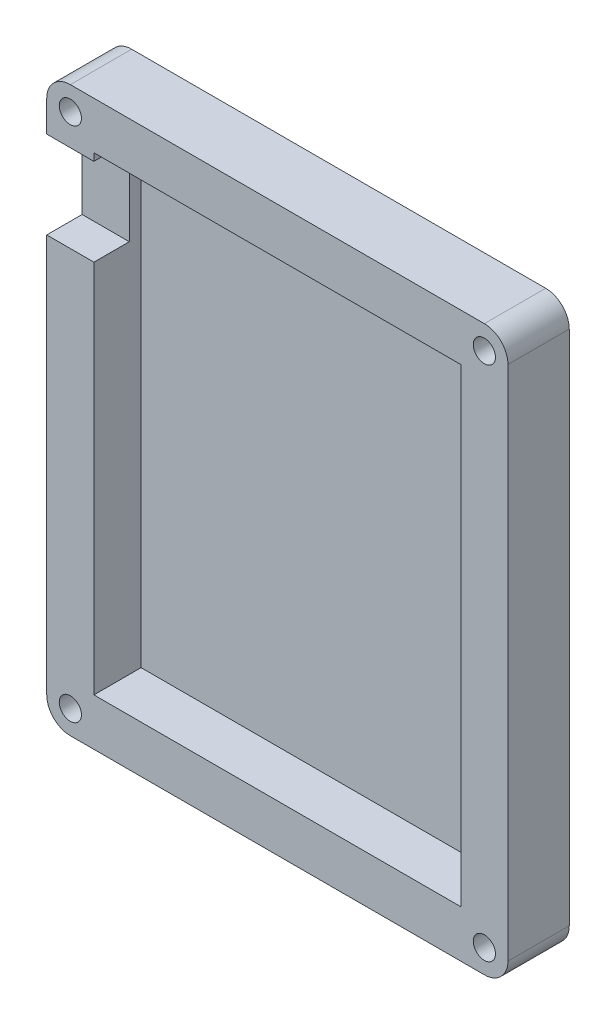
from build123d import *

# Parameters (mm, degrees)
SKETCH4_R             = 3
SKETCH4_R_2           = 2.35
BOSS_EXTRUDE1_DEPTH   = 9.9
BOSS_EXTRUDE1_2_DEPTH = 9.9
BOSS_EXTRUDE1_3_DEPTH = 9.9
BOSS_EXTRUDE1_4_DEPTH = 9.9
SKETCH1_R             = 3
BOSS_EXTRUDE2_DEPTH   = 13
BOSS_EXTRUDE3_DEPTH   = 3
SKETCH5_W             = 10
SKETCH5_H             = 18.5
CUT_EXTRUDE1_DEPTH    = 7.5
FILLET1_R             = 5
CUT_EXTRUDE2_DEPTH    = 0.2


with BuildPart() as part:
    # Sketch4 → Boss-Extrude1 (new body)
    with BuildSketch(Plane(origin=(0, 0, 3.1), x_dir=(0, 1, 0), z_dir=(0, 0, 1))):
        with Locations(Location((-54.765, -43.88, 0), (0, 0, 90))):
            Circle(SKETCH4_R)
        with Locations(Location((-54.765, -43.88, 0), (0, 0, 90))):
            Circle(SKETCH4_R_2, mode=Mode.SUBTRACT)
    extrude(amount=BOSS_EXTRUDE1_DEPTH)



with BuildPart() as body_2:
    # Sketch4 → Boss-Extrude1 2 (new body)
    with BuildSketch(Plane(origin=(0, 0, 3.1), x_dir=(0, 1, 0), z_dir=(0, 0, 1))):
        with Locations(Location((54.765, -43.88, 0), (0, 0, 90))):
            Circle(SKETCH4_R)
        with Locations(Location((54.765, -43.88, 0), (0, 0, 90))):
            Circle(SKETCH4_R_2, mode=Mode.SUBTRACT)
    extrude(amount=BOSS_EXTRUDE1_2_DEPTH)


with BuildPart() as body_3:
    # Sketch4 → Boss-Extrude1 3 (new body)
    with BuildSketch(Plane(origin=(0, 0, 3.1), x_dir=(0, 1, 0), z_dir=(0, 0, 1))):
        with Locations(Location((54.765, 43.88, 0), (0, 0, 90))):
            Circle(SKETCH4_R)
        with Locations(Location((54.765, 43.88, 0), (0, 0, 90))):
            Circle(SKETCH4_R_2, mode=Mode.SUBTRACT)
    extrude(amount=BOSS_EXTRUDE1_3_DEPTH)


with BuildPart() as body_4:
    # Sketch4 → Boss-Extrude1 4 (new body)
    with BuildSketch(Plane(origin=(0, 0, 3.1), x_dir=(0, 1, 0), z_dir=(0, 0, 1))):
        with Locations(Location((-54.765, 43.88, 0), (0, 0, 90))):
            Circle(SKETCH4_R)
        with Locations(Location((-54.765, 43.88, 0), (0, 0, 90))):
            Circle(SKETCH4_R_2, mode=Mode.SUBTRACT)
    extrude(amount=BOSS_EXTRUDE1_4_DEPTH)


with BuildPart() as part_1:
    add(part.part)

    add(body_2.part)  # Boss-Extrude2 merges body 2

    add(body_3.part)  # Boss-Extrude2 merges body 3

    add(body_4.part)  # Boss-Extrude2 merges body 4
    # Sketch1 → Boss-Extrude2 (add)
    with BuildSketch(Plane(origin=(0, 0, 0), x_dir=(0, 1, 0), z_dir=(0, 0, 1))):
        Polygon((59.765, 48.88), (59.765, 63.831620916), (59.765, -48.88), (-59.765, -48.88), (-59.765, 48.88), (18.337488683, 48.88), align=None)
        with Locations(Location((-54.765, -43.88, 0), (0, 0, 90))):
            Circle(SKETCH1_R, mode=Mode.SUBTRACT)
        with Locations(Location((54.765, -43.88, 0), (0, 0, 90))):
            Circle(SKETCH1_R, mode=Mode.SUBTRACT)
        with Locations(Location((54.765, 43.88, 0), (0, 0, 90))):
            Circle(SKETCH1_R, mode=Mode.SUBTRACT)
        with Locations(Location((-54.765, 43.88, 0), (0, 0, 90))):
            Circle(SKETCH1_R, mode=Mode.SUBTRACT)
        Polygon((18.074158975, 38.88), (49.765, 38.88), (49.765, 53.831620916), (49.765, -38.88), (-49.765, -38.88), (-49.765, 38.88), align=None, mode=Mode.SUBTRACT)
    extrude(amount=BOSS_EXTRUDE2_DEPTH)

    # Sketch1<10> → Boss-Extrude3 (add)
    with BuildSketch(Plane(origin=(0, 0, 0), x_dir=(0, 1, 0), z_dir=(0, 0, 1))):
        Polygon((49.765, 38.88), (49.765, 53.831620916), (49.765, -38.88), (-49.765, -38.88), (-49.765, 38.88), (18.074158975, 38.88), align=None)
    extrude(amount=BOSS_EXTRUDE3_DEPTH)

    # Sketch5 → Cut-Extrude1 (cut)
    with BuildSketch(Plane.XY.offset(13)):
        with Locations((-43.88, 38.925)):
            Rectangle(SKETCH5_W, SKETCH5_H)
    extrude(amount=-CUT_EXTRUDE1_DEPTH, mode=Mode.SUBTRACT)

    # Fillet1
    fillet1_edges = [part_1.edges().sort_by_distance(p)[0] for p in [
        (-48.88, 59.765, 6.5),
        (-48.88, -59.765, 6.5),
        (48.88, -59.765, 6.5),
        (48.88, 59.765, 6.5),
    ]]
    fillet(fillet1_edges, radius=FILLET1_R)

    # Sketch6 → Cut-Extrude2 (cut)
    # profile 1 of 17: a face of its own
    with BuildSketch(Plane(origin=(0, 0, 0), x_dir=(1, 0, 0), z_dir=(0, 0, -1))):
        Polygon((-25.373933233, -2.992088032), (-24.91189397, 0.507911968), (-24.867022175, 0.507911968), (-23.422010156, -2.363882904), (-21.980503746, 0.507911968), (-21.934930829, 0.507911968), (-21.470087079, -2.992088032), (-21.785591887, -2.992088032), (-22.120728105, -0.473658545), (-23.384149579, -2.992088032), (-23.45496288, -2.992088032), (-24.723292207, -0.468049571), (-25.057727303, -2.992088032), align=None)
    # profile 2 of 17: a face of its own
    with BuildSketch(Plane(origin=(0, 0, 0), x_dir=(1, 0, 0), z_dir=(0, 0, -1))):
        with BuildLine():
            add(Edge.make_bspline(
                [(-19.606505348, -0.38952393), (-19.558514075, -0.390545821), (-19.464414918, -0.3925495), (-19.326607032, -0.413964465), (-19.195061896, -0.44671183), (-19.069275704, -0.491983392), (-18.950859408, -0.552665342), (-18.838088164, -0.625074633), (-18.731271155, -0.710857227), (-18.667248126, -0.777215295), (-18.63475054, -0.810898128)],
                knots=[0, 0, 0, 0, 1.054011418, 2.066658804, 3.057071809, 4.030435133, 4.997543892, 5.974964718, 6.972108034, 8, 8, 8, 8], degree=3))
            add(Edge.make_bspline(
                [(-18.63475054, -0.810898128), (-18.606768586, -0.843112114), (-18.551346206, -0.906916656), (-18.480280487, -1.010372269), (-18.419058927, -1.11751237), (-18.369995966, -1.229759697), (-18.331310942, -1.346134368), (-18.303845246, -1.467036379), (-18.287508311, -1.592198726), (-18.285305344, -1.677202564), (-18.284189643, -1.720253096)],
                knots=[0, 0, 0, 0, 1.025258237, 2.030674902, 3.01204498, 3.988269485, 4.97094183, 5.956517959, 6.965070386, 8, 8, 8, 8], degree=3))
            add(Edge.make_bspline(
                [(-18.284189643, -1.720253096), (-18.28517098, -1.763553154), (-18.287110149, -1.849116087), (-18.305453765, -1.975135453), (-18.333984851, -2.097330276), (-18.374816689, -2.21518897), (-18.427174798, -2.329071797), (-18.491065486, -2.438481346), (-18.566937103, -2.54363348), (-18.6529411, -2.643635318), (-18.747992976, -2.735801533), (-18.851109124, -2.816129802), (-18.960263158, -2.884951327), (-19.076906511, -2.940387742), (-19.199973998, -2.984097442), (-19.329731066, -3.014797459), (-19.465976136, -3.033359143), (-19.559003358, -3.035742716), (-19.606505348, -3.036959827)],
                knots=[0, 0, 0, 0, 0.998656419, 1.973391657, 2.932242238, 3.890759089, 4.846373663, 5.82037756, 6.809684879, 7.83454468, 8.860553229, 9.859544525, 10.845671541, 11.83227036, 12.833544569, 13.85385346, 14.904124723, 16, 16, 16, 16], degree=3))
            add(Edge.make_bspline(
                [(-19.606505348, -3.036959827), (-19.654240068, -3.035738631), (-19.747730927, -3.033346856), (-19.884456909, -3.014869574), (-20.014446528, -2.984111591), (-20.137675127, -2.940244098), (-20.254819974, -2.884949555), (-20.364606471, -2.816337865), (-20.467806386, -2.73577771), (-20.562878371, -2.643641773), (-20.648876976, -2.543631816), (-20.724749984, -2.438481778), (-20.78864031, -2.329071685), (-20.840998514, -2.215189), (-20.881830327, -2.097330268), (-20.91036142, -1.975135455), (-20.928705034, -1.849116087), (-20.930644203, -1.763553154), (-20.93162554, -1.720253096)],
                knots=[0, 0, 0, 0, 1.099876186, 2.154163076, 3.173186993, 4.173200201, 5.163417411, 6.152872554, 7.150605724, 8.17532212, 9.198891216, 10.186952605, 11.159729845, 12.11414092, 13.071450619, 14.029093627, 15.002601286, 16, 16, 16, 16], degree=3))
            add(Edge.make_bspline(
                [(-20.93162554, -1.720253096), (-20.93050223, -1.67743655), (-20.928278269, -1.592667148), (-20.91195776, -1.467740087), (-20.884599203, -1.347042698), (-20.845867807, -1.231117222), (-20.796352616, -1.119361786), (-20.735991328, -1.011956955), (-20.664200695, -0.908969155), (-20.608998744, -0.845247075), (-20.581064643, -0.813001494)],
                knots=[0, 0, 0, 0, 1.031353054, 2.041901799, 3.029428768, 4.008703097, 4.981709435, 5.96992636, 6.972712378, 8, 8, 8, 8], degree=3))
            add(Edge.make_bspline(
                [(-20.581064643, -0.813001494), (-20.548616052, -0.779026555), (-20.484800188, -0.712208858), (-20.37745146, -0.626676334), (-20.264957639, -0.55276026), (-20.145232713, -0.493284045), (-20.019549855, -0.446445527), (-19.887330613, -0.413880012), (-19.749055097, -0.392626657), (-19.654495476, -0.390568479), (-19.606505348, -0.38952393)],
                knots=[0, 0, 0, 0, 1.027980169, 2.021703884, 2.998553061, 3.971491411, 4.943284454, 5.930300938, 6.949603206, 8, 8, 8, 8], degree=3))
        make_face()
        with BuildLine():
            add(Edge.make_bspline(
                [(-19.607907592, -0.703626494), (-19.641845203, -0.704591085), (-19.708844332, -0.706495368), (-19.807463916, -0.720979273), (-19.90240407, -0.743926777), (-19.993844914, -0.776530833), (-20.081478087, -0.818629732), (-20.165387489, -0.870338092), (-20.245819929, -0.930971049), (-20.321201993, -1.00043372), (-20.390384305, -1.076312715), (-20.450862281, -1.157161074), (-20.502287388, -1.24166742), (-20.545127547, -1.329919631), (-20.577034735, -1.422812045), (-20.600207757, -1.519292676), (-20.614677998, -1.619558093), (-20.616564376, -1.687719111), (-20.617522976, -1.722356462)],
                knots=[0, 0, 0, 0, 1.021534396, 2.016698045, 2.994645724, 3.958388632, 4.93408049, 5.916473867, 6.921342795, 7.962252576, 8.998418191, 10.008913653, 10.997312074, 11.973003931, 12.956656626, 13.948281152, 14.957379055, 16, 16, 16, 16], degree=3))
            add(Edge.make_bspline(
                [(-20.617522976, -1.722356462), (-20.615916153, -1.767108489), (-20.612726908, -1.855932894), (-20.586791672, -1.986744017), (-20.543405392, -2.112325869), (-20.484818112, -2.231942255), (-20.411411894, -2.342614533), (-20.324924827, -2.441286018), (-20.226285126, -2.526471829), (-20.116668626, -2.597152675), (-19.998314308, -2.65331243), (-19.873057987, -2.693111406), (-19.742417293, -2.718983098), (-19.653136562, -2.721554573), (-19.607907592, -2.722857263)],
                knots=[0, 0, 0, 0, 1.016792936, 2.018143844, 3.017858371, 4.030088057, 5.03801393, 6.028138512, 7.003788237, 7.991172063, 8.984598303, 9.972568034, 10.972917682, 12, 12, 12, 12], degree=3))
            add(Edge.make_bspline(
                [(-19.607907592, -2.722857263), (-19.562681223, -2.721546983), (-19.473405627, -2.718960526), (-19.34294645, -2.693241706), (-19.218032478, -2.653138045), (-19.099801091, -2.597215836), (-18.990234487, -2.526203421), (-18.890885366, -2.441767044), (-18.805136755, -2.342353192), (-18.73180315, -2.231795664), (-18.672256407, -2.112511311), (-18.629073205, -1.986720839), (-18.603075619, -1.855938797), (-18.599894791, -1.767110467), (-18.598292207, -1.722356462)],
                knots=[0, 0, 0, 0, 1.02726834, 2.027799167, 3.010890988, 4.004497153, 4.992059811, 5.971914811, 6.958719428, 7.966827853, 8.981595046, 9.981490638, 10.983022906, 12, 12, 12, 12], degree=3))
            add(Edge.make_bspline(
                [(-18.598292207, -1.722356462), (-18.599250477, -1.687718904), (-18.601136206, -1.619557478), (-18.615611171, -1.519295025), (-18.63876671, -1.422803428), (-18.670738328, -1.329951425), (-18.713392341, -1.241438921), (-18.765809134, -1.157409193), (-18.82604016, -1.076032647), (-18.896057281, -1.000679007), (-18.971360659, -0.93094397), (-19.051825697, -0.870314581), (-19.135610675, -0.818856985), (-19.222989258, -0.776170745), (-19.314441826, -0.744223404), (-19.409248955, -0.720846773), (-19.507447765, -0.706556576), (-19.574206808, -0.704609435), (-19.607907592, -0.703626494)],
                knots=[0, 0, 0, 0, 1.042956736, 2.052379634, 3.044323526, 4.02829302, 5.004299113, 5.996692471, 7.007513377, 8.048758398, 9.090003419, 10.095195979, 11.07790575, 12.047570684, 13.018257071, 13.989683339, 14.985167495, 16, 16, 16, 16], degree=3))
        make_face(mode=Mode.SUBTRACT)
    # profile 3 of 17: a face of its own
    with BuildSketch(Plane(origin=(0, 0, 0), x_dir=(1, 0, 0), z_dir=(0, 0, -1))):
        with BuildLine():
            Line((-15.053420412, -0.434395725), (-15.053420412, -2.992088032))
            Line((-15.053420412, -2.992088032), (-15.367522976, -2.992088032))
            Line((-15.367522976, -2.992088032), (-15.367522976, -2.54968018))
            add(Edge.make_bspline(
                [(-15.367522976, -2.54968018), (-15.402941767, -2.589719774), (-15.472061982, -2.667857545), (-15.5875031, -2.769939717), (-15.709871278, -2.854318039), (-15.838572599, -2.922467954), (-15.973490843, -2.973660011), (-16.11432693, -3.01004617), (-16.261138311, -3.033440005), (-16.361390665, -3.035776027), (-16.412194451, -3.036959827)],
                knots=[0, 0, 0, 0, 1.074387032, 2.096679803, 3.090159297, 4.057316773, 5.018401886, 5.985159533, 6.978961417, 8, 8, 8, 8], degree=3))
            add(Edge.make_bspline(
                [(-16.412194451, -3.036959827), (-16.457362404, -3.035733455), (-16.546435609, -3.033314994), (-16.677464687, -3.014552691), (-16.803556936, -2.984422069), (-16.924831509, -2.94252118), (-17.040503654, -2.886940358), (-17.151563751, -2.82039911), (-17.257436443, -2.74115828), (-17.356507982, -2.650570252), (-17.447739982, -2.552175264), (-17.527801255, -2.447229718), (-17.594554335, -2.336187414), (-17.650374415, -2.22045426), (-17.69337076, -2.09913934), (-17.723344394, -1.972662172), (-17.742084841, -1.841172299), (-17.744502301, -1.751632776), (-17.745728105, -1.70623066)],
                knots=[0, 0, 0, 0, 1.033919861, 2.038935746, 3.024066025, 3.998881131, 4.97069526, 5.957263378, 6.95902576, 7.993208707, 9.027059324, 10.027763471, 11.009749337, 11.988697705, 12.965288445, 13.950418724, 14.960734635, 16, 16, 16, 16], degree=3))
            add(Edge.make_bspline(
                [(-17.745728105, -1.70623066), (-17.744475133, -1.661766957), (-17.741998076, -1.573864614), (-17.723544856, -1.444585916), (-17.692513848, -1.320067655), (-17.648966, -1.200710712), (-17.593124045, -1.086370661), (-17.525195958, -0.976966636), (-17.445176833, -0.872197239), (-17.352924426, -0.774526012), (-17.252989656, -0.684305398), (-17.146080925, -0.605896352), (-17.034857644, -0.538179504), (-16.917594634, -0.484526027), (-16.796027529, -0.441116923), (-16.669074083, -0.411083955), (-16.537262504, -0.393386633), (-16.447772012, -0.390823869), (-16.402378746, -0.38952393)],
                knots=[0, 0, 0, 0, 1.020392517, 2.01726096, 2.990465484, 3.961182959, 4.928053699, 5.906110375, 6.912531644, 7.948652711, 8.985773172, 9.998621852, 10.987621588, 11.969261332, 12.953316658, 13.946091881, 14.958173133, 16, 16, 16, 16], degree=3))
            add(Edge.make_bspline(
                [(-16.402378746, -0.38952393), (-16.350178886, -0.390961681), (-16.247817426, -0.393781044), (-16.098089417, -0.417243771), (-15.956444939, -0.456882239), (-15.821790587, -0.510799737), (-15.694609901, -0.582448466), (-15.576106917, -0.672828427), (-15.465041434, -0.781369614), (-15.400661142, -0.864740058), (-15.367522976, -0.907652936)],
                knots=[0, 0, 0, 0, 1.038897134, 2.037228247, 3.008116434, 3.962042015, 4.918381754, 5.904844433, 6.921570401, 8, 8, 8, 8], degree=3))
            Line((-15.367522976, -0.907652936), (-15.367522976, -0.434395725))
            Line((-15.367522976, -0.434395725), (-15.053420412, -0.434395725))
        make_face()
        with BuildLine():
            add(Edge.make_bspline(
                [(-16.398172015, -0.703626494), (-16.444086353, -0.705260132), (-16.534713953, -0.708484673), (-16.667757955, -0.733658168), (-16.795071369, -0.775542762), (-16.916017443, -0.832824663), (-17.02868566, -0.9048534), (-17.12937933, -0.991974783), (-17.218922032, -1.091811797), (-17.294230296, -1.203913908), (-17.355620793, -1.324091999), (-17.398787825, -1.449716437), (-17.427257072, -1.578521414), (-17.430165593, -1.6658841), (-17.43162554, -1.709736269)],
                knots=[0, 0, 0, 0, 1.031046209, 2.035121221, 3.029706178, 4.034933723, 5.034054252, 6.02443088, 7.017295772, 8.038157696, 9.050218397, 10.03989886, 11.016116709, 12, 12, 12, 12], degree=3))
            add(Edge.make_bspline(
                [(-17.43162554, -1.709736269), (-17.429760647, -1.753326377), (-17.42603817, -1.840335732), (-17.399287476, -1.969316309), (-17.354407602, -2.094970351), (-17.29316554, -2.216231345), (-17.216478915, -2.328815445), (-17.127590262, -2.430555568), (-17.025639981, -2.518045156), (-16.912712474, -2.59128273), (-16.792104504, -2.650445251), (-16.665270572, -2.69161089), (-16.534594934, -2.718188671), (-16.4457426, -2.721293148), (-16.400976502, -2.722857263)],
                knots=[0, 0, 0, 0, 0.979072187, 1.954306742, 2.945804271, 3.96968567, 4.997920485, 5.998718438, 6.996577872, 8.005894225, 9.015743152, 10.005417472, 10.995077863, 12, 12, 12, 12], degree=3))
            add(Edge.make_bspline(
                [(-16.400976502, -2.722857263), (-16.355529999, -2.721197299), (-16.265141413, -2.717895795), (-16.131702705, -2.69261453), (-16.002207742, -2.650845732), (-15.878420514, -2.592946605), (-15.763104382, -2.521189249), (-15.659606505, -2.437182158), (-15.572090536, -2.339478974), (-15.497897927, -2.232102521), (-15.43972251, -2.114390525), (-15.397346451, -1.989056334), (-15.372292545, -1.856095586), (-15.369134816, -1.765231659), (-15.367522976, -1.718850853)],
                knots=[0, 0, 0, 0, 1.01762866, 2.023962475, 3.030623092, 4.058876274, 5.077231937, 6.066672613, 7.034107872, 8.005628644, 8.981990164, 9.965428785, 10.961468474, 12, 12, 12, 12], degree=3))
            add(Edge.make_bspline(
                [(-15.367522976, -1.718850853), (-15.368482633, -1.683513022), (-15.37037154, -1.613956989), (-15.38480211, -1.511829471), (-15.407757036, -1.414095745), (-15.440103206, -1.320653056), (-15.48259449, -1.232018041), (-15.533842256, -1.147554281), (-15.594747706, -1.067701069), (-15.664330402, -0.993557998), (-15.740495605, -0.925931536), (-15.821090145, -0.865567295), (-15.907068892, -0.815978523), (-15.996985929, -0.774937251), (-16.090997264, -0.742278101), (-16.189867884, -0.720490407), (-16.29254687, -0.705530086), (-16.362592926, -0.704267706), (-16.398172015, -0.703626494)],
                knots=[0, 0, 0, 0, 1.050140795, 2.067009409, 3.05949893, 4.030605086, 5.00011959, 5.97591094, 6.962425594, 7.979863591, 8.993523472, 9.986985069, 10.967611495, 11.937549037, 12.921786183, 13.919465291, 14.943216303, 16, 16, 16, 16], degree=3))
        make_face(mode=Mode.SUBTRACT)
    # profile 4 of 17: a face of its own
    with BuildSketch(Plane(origin=(0, 0, 0), x_dir=(1, 0, 0), z_dir=(0, 0, -1))):
        Polygon((-14.559830669, -0.434395725), (-12.630343489, -0.434395725), (-14.118123938, -2.677985468), (-12.675215284, -2.677985468), (-12.675215284, -2.992088032), (-14.694446053, -2.992088032), (-13.205964483, -0.748498289), (-14.559830669, -0.748498289), align=None)
    # profile 5 of 17: a face of its own
    with BuildSketch(Plane(origin=(0, 0, 0), x_dir=(1, 0, 0), z_dir=(0, 0, -1))):
        Polygon((-12.096088681, -0.479267519), (-12.31413756, -0.479267519), (-12.36111272, 0.597655557), (-12.047010156, 0.597655557), align=None)
    # profile 6 of 17: a face of its own
    with BuildSketch(Plane(origin=(0, 0, 0), x_dir=(1, 0, 0), z_dir=(0, 0, -1))):
        with BuildLine():
            Line((-10.117522976, -0.753406141), (-10.330664002, -0.972857263))
            add(Edge.make_bspline(
                [(-10.330664002, -0.972857263), (-10.349054505, -0.951544117), (-10.384509231, -0.91045488), (-10.440740712, -0.855517813), (-10.496764316, -0.809380874), (-10.551813129, -0.770428615), (-10.607271398, -0.740979469), (-10.662488317, -0.719484607), (-10.717521055, -0.706182801), (-10.75430709, -0.704468362), (-10.772370733, -0.703626494)],
                knots=[0, 0, 0, 0, 1.26578478, 2.440284043, 3.530471711, 4.527705817, 5.468200915, 6.346673037, 7.188140097, 8, 8, 8, 8], degree=3))
            add(Edge.make_bspline(
                [(-10.772370733, -0.703626494), (-10.794510123, -0.704701367), (-10.838077308, -0.706816565), (-10.900503127, -0.727929995), (-10.958453752, -0.760338733), (-11.008610732, -0.806307317), (-11.051098412, -0.859071586), (-11.082112093, -0.918067911), (-11.101078077, -0.981515954), (-11.103482809, -1.025545812), (-11.104702463, -1.047877295)],
                knots=[0, 0, 0, 0, 0.99966794, 1.967205029, 2.953328237, 3.988086729, 5.028030931, 6.008226631, 6.989793394, 8, 8, 8, 8], degree=3))
            add(Edge.make_bspline(
                [(-11.104702463, -1.047877295), (-11.103591651, -1.068089339), (-11.101373158, -1.10845645), (-11.084126479, -1.168004484), (-11.056660407, -1.226061522), (-11.030990212, -1.261624428), (-11.017763361, -1.279948609)],
                knots=[0, 0, 0, 0, 0.960159726, 1.917612774, 2.927026955, 4, 4, 4, 4], degree=3))
            add(Edge.make_bspline(
                [(-11.017763361, -1.279948609), (-11.009799867, -1.289733194), (-10.992850574, -1.310558448), (-10.961042059, -1.339462301), (-10.925019556, -1.371404552), (-10.881699619, -1.403341389), (-10.832948591, -1.436973115), (-10.777709307, -1.470975248), (-10.717734802, -1.507939673), (-10.674797495, -1.531384108), (-10.652478906, -1.543570404)],
                knots=[0, 0, 0, 0, 0.66740084, 1.420478572, 2.27185888, 3.217733974, 4.268547843, 5.408967954, 6.65319498, 8, 8, 8, 8], degree=3))
            add(Edge.make_bspline(
                [(-10.652478906, -1.543570404), (-10.625265329, -1.558815307), (-10.572697659, -1.588263439), (-10.498004891, -1.633973143), (-10.43021785, -1.679404567), (-10.368762183, -1.724071841), (-10.314820374, -1.769224709), (-10.266755821, -1.813132466), (-10.225767377, -1.857121774), (-10.202813451, -1.887854887), (-10.191841887, -1.902544763)],
                knots=[0, 0, 0, 0, 1.27191281, 2.456916733, 3.569705269, 4.599008579, 5.553216877, 6.436649441, 7.252746552, 8, 8, 8, 8], degree=3))
            add(Edge.make_bspline(
                [(-10.191841887, -1.902544763), (-10.173631359, -1.932210851), (-10.13738903, -1.991251872), (-10.099330763, -2.0884703), (-10.077270489, -2.191580802), (-10.074208268, -2.262113022), (-10.072651181, -2.297977455)],
                knots=[0, 0, 0, 0, 0.995354457, 1.980940102, 2.973342416, 4, 4, 4, 4], degree=3))
            add(Edge.make_bspline(
                [(-10.072651181, -2.297977455), (-10.073370715, -2.323246602), (-10.074788635, -2.373042215), (-10.084646702, -2.446377044), (-10.101601678, -2.516511602), (-10.124695432, -2.584206887), (-10.155879805, -2.648165826), (-10.192427603, -2.710002075), (-10.236302514, -2.768378006), (-10.28639389, -2.823216966), (-10.341239384, -2.873302714), (-10.399745522, -2.917326667), (-10.461984353, -2.953901005), (-10.527511154, -2.98416635), (-10.596474808, -3.008234608), (-10.668886098, -3.024897139), (-10.744514852, -3.0348699), (-10.79594466, -3.036254376), (-10.82215038, -3.036959827)],
                knots=[0, 0, 0, 0, 1.032770009, 2.035186124, 3.017557409, 3.978232242, 4.952395191, 5.920591857, 6.910227898, 7.931268572, 8.952309245, 9.941945286, 10.918353717, 11.897095711, 12.887975737, 13.898235213, 14.929059601, 16, 16, 16, 16], degree=3))
            add(Edge.make_bspline(
                [(-10.82215038, -3.036959827), (-10.857517556, -3.035967127), (-10.927760483, -3.03399552), (-11.031650202, -3.015489458), (-11.13317096, -2.986694065), (-11.231554501, -2.94697813), (-11.324600615, -2.896827417), (-11.409731539, -2.836765024), (-11.487243002, -2.768775027), (-11.531361275, -2.716662116), (-11.553420412, -2.69060566)],
                knots=[0, 0, 0, 0, 1.013940152, 2.01379169, 3.017749504, 4.037548394, 5.051665909, 6.043208538, 7.021604269, 8, 8, 8, 8], degree=3))
            Line((-11.553420412, -2.69060566), (-11.345187239, -2.453626494))
            add(Edge.make_bspline(
                [(-11.345187239, -2.453626494), (-11.325414826, -2.474981258), (-11.287083014, -2.516380698), (-11.225781797, -2.571505039), (-11.163402396, -2.61770631), (-11.100567709, -2.656349725), (-11.036347615, -2.686125128), (-10.971102001, -2.707043722), (-10.904963577, -2.720487914), (-10.860541441, -2.722066196), (-10.838276181, -2.722857263)],
                knots=[0, 0, 0, 0, 1.179806542, 2.287233372, 3.337373186, 4.324005949, 5.273901747, 6.200048787, 7.097828587, 8, 8, 8, 8], degree=3))
            add(Edge.make_bspline(
                [(-10.838276181, -2.722857263), (-10.807958255, -2.721486438), (-10.748722114, -2.718808076), (-10.663878355, -2.694490984), (-10.585539729, -2.656361032), (-10.517516383, -2.602276334), (-10.459614222, -2.539320762), (-10.417686048, -2.468406642), (-10.391409872, -2.391615186), (-10.388323874, -2.338382883), (-10.386753746, -2.311298769)],
                knots=[0, 0, 0, 0, 1.072336372, 2.095165389, 3.102688358, 4.141489647, 5.156069229, 6.117746104, 7.042326257, 8, 8, 8, 8], degree=3))
            add(Edge.make_bspline(
                [(-10.386753746, -2.311298769), (-10.38784004, -2.288989151), (-10.389984783, -2.244941795), (-10.406828055, -2.181191454), (-10.433440907, -2.120722173), (-10.459645555, -2.085332526), (-10.472991726, -2.067308385)],
                knots=[0, 0, 0, 0, 1.013901739, 2.00181326, 2.98231254, 4, 4, 4, 4], degree=3))
            add(Edge.make_bspline(
                [(-10.472991726, -2.067308385), (-10.481014121, -2.058273023), (-10.498489793, -2.038590741), (-10.530545034, -2.010165662), (-10.568926897, -1.979527563), (-10.61406706, -1.947195974), (-10.666056522, -1.913597368), (-10.725105997, -1.878908016), (-10.790406549, -1.84148029), (-10.836577181, -1.816660635), (-10.860712079, -1.80368659)],
                knots=[0, 0, 0, 0, 0.615000592, 1.339693406, 2.178160186, 3.116406724, 4.166410947, 5.330106347, 6.604359322, 8, 8, 8, 8], degree=3))
            add(Edge.make_bspline(
                [(-10.860712079, -1.80368659), (-10.886758719, -1.789147458), (-10.937271466, -1.760951442), (-11.008818757, -1.717035362), (-11.073366112, -1.672368087), (-11.132466686, -1.629455248), (-11.184627692, -1.586034304), (-11.22964364, -1.542057052), (-11.269286856, -1.499297066), (-11.291234268, -1.46899977), (-11.301717688, -1.454527936)],
                knots=[0, 0, 0, 0, 1.262093308, 2.447601706, 3.550203992, 4.582594899, 5.537233252, 6.418365656, 7.244515135, 8, 8, 8, 8], degree=3))
            add(Edge.make_bspline(
                [(-11.301717688, -1.454527936), (-11.319848287, -1.425382321), (-11.356115823, -1.367080906), (-11.391331014, -1.269770429), (-11.415537043, -1.167325372), (-11.417699433, -1.096638517), (-11.418805028, -1.060497487)],
                knots=[0, 0, 0, 0, 0.985009483, 1.970363186, 2.962279964, 4, 4, 4, 4], degree=3))
            add(Edge.make_bspline(
                [(-11.418805028, -1.060497487), (-11.418270832, -1.036872089), (-11.417225336, -0.990633838), (-11.408881285, -0.922695018), (-11.393689574, -0.858146864), (-11.374634651, -0.796020001), (-11.348151647, -0.737517907), (-11.316505741, -0.681860436), (-11.279318316, -0.629124518), (-11.236475026, -0.580121386), (-11.18936838, -0.53561206), (-11.138473611, -0.496813432), (-11.084935354, -0.463707077), (-11.028526934, -0.435941916), (-10.968706462, -0.414940534), (-10.905892075, -0.400483149), (-10.84021092, -0.390827946), (-10.795309794, -0.389964862), (-10.772370733, -0.38952393)],
                knots=[0, 0, 0, 0, 1.087655834, 2.128696564, 3.144119009, 4.137814668, 5.115653402, 6.093965665, 7.082169637, 8.081268856, 9.086088321, 10.061021666, 11.022561449, 11.980240094, 12.950172527, 13.934149372, 14.944599409, 16, 16, 16, 16], degree=3))
            add(Edge.make_bspline(
                [(-10.772370733, -0.38952393), (-10.745178669, -0.39062827), (-10.690284447, -0.392857668), (-10.607929821, -0.410563359), (-10.525696479, -0.439696463), (-10.443373129, -0.479932696), (-10.36156284, -0.531999572), (-10.279545983, -0.594928871), (-10.196337953, -0.668306586), (-10.14438164, -0.724405811), (-10.117522976, -0.753406141)],
                knots=[0, 0, 0, 0, 0.845714091, 1.707292901, 2.609013841, 3.555613372, 4.552488639, 5.621697636, 6.770543573, 8, 8, 8, 8], degree=3))
        make_face()
    # profile 7 of 17: a face of its own
    with BuildSketch(Plane(origin=(0, 0, 0), x_dir=(1, 0, 0), z_dir=(0, 0, -1))):
        Polygon((-8.008548617, 0.507911968), (-7.694446053, 0.507911968), (-7.694446053, -0.927985468), (-5.899574258, -0.927985468), (-5.899574258, 0.507911968), (-5.585471694, 0.507911968), (-5.585471694, -2.992088032), (-5.899574258, -2.992088032), (-5.899574258, -1.286959827), (-7.694446053, -1.286959827), (-7.694446053, -2.992088032), (-8.008548617, -2.992088032), align=None)
    # profile 8 of 17: a face of its own
    with BuildSketch(Plane(origin=(0, 0, 0), x_dir=(1, 0, 0), z_dir=(0, 0, -1))):
        with BuildLine():
            Line((-2.175215284, -0.434395725), (-2.175215284, -2.992088032))
            Line((-2.175215284, -2.992088032), (-2.489317848, -2.992088032))
            Line((-2.489317848, -2.992088032), (-2.489317848, -2.54968018))
            add(Edge.make_bspline(
                [(-2.489317848, -2.54968018), (-2.524736639, -2.589719774), (-2.593856854, -2.667857545), (-2.709297972, -2.769939717), (-2.83166615, -2.854318039), (-2.960367471, -2.922467954), (-3.095285714, -2.973660011), (-3.236121802, -3.01004617), (-3.382933182, -3.033440005), (-3.483185537, -3.035776027), (-3.533989322, -3.036959827)],
                knots=[0, 0, 0, 0, 1.074387032, 2.096679803, 3.090159297, 4.057316773, 5.018401886, 5.985159533, 6.978961417, 8, 8, 8, 8], degree=3))
            add(Edge.make_bspline(
                [(-3.533989322, -3.036959827), (-3.579157276, -3.035733455), (-3.668230481, -3.033314994), (-3.799259558, -3.014552691), (-3.925351808, -2.984422069), (-4.04662638, -2.94252118), (-4.162298526, -2.886940358), (-4.273358623, -2.82039911), (-4.379231315, -2.74115828), (-4.478302854, -2.650570252), (-4.569534854, -2.552175264), (-4.649596127, -2.447229718), (-4.716349206, -2.336187414), (-4.772169287, -2.22045426), (-4.815165632, -2.09913934), (-4.845139266, -1.972662172), (-4.863879712, -1.841172299), (-4.866297173, -1.751632776), (-4.867522976, -1.70623066)],
                knots=[0, 0, 0, 0, 1.033919861, 2.038935746, 3.024066025, 3.998881131, 4.97069526, 5.957263378, 6.95902576, 7.993208707, 9.027059324, 10.027763471, 11.009749337, 11.988697705, 12.965288445, 13.950418724, 14.960734635, 16, 16, 16, 16], degree=3))
            add(Edge.make_bspline(
                [(-4.867522976, -1.70623066), (-4.866270005, -1.661766957), (-4.863792948, -1.573864614), (-4.845339728, -1.444585916), (-4.81430872, -1.320067655), (-4.770760872, -1.200710712), (-4.714918917, -1.086370661), (-4.64699083, -0.976966636), (-4.566971705, -0.872197239), (-4.474719298, -0.774526012), (-4.374784528, -0.684305398), (-4.267875797, -0.605896352), (-4.156652516, -0.538179504), (-4.039389505, -0.484526027), (-3.9178224, -0.441116923), (-3.790868955, -0.411083955), (-3.659057376, -0.393386633), (-3.569566884, -0.390823869), (-3.524173617, -0.38952393)],
                knots=[0, 0, 0, 0, 1.020392517, 2.01726096, 2.990465484, 3.961182959, 4.928053699, 5.906110375, 6.912531644, 7.948652711, 8.985773172, 9.998621852, 10.987621588, 11.969261332, 12.953316658, 13.946091881, 14.958173133, 16, 16, 16, 16], degree=3))
            add(Edge.make_bspline(
                [(-3.524173617, -0.38952393), (-3.471973758, -0.390961681), (-3.369612298, -0.393781044), (-3.219884289, -0.417243771), (-3.078239811, -0.456882239), (-2.943585459, -0.510799737), (-2.816404773, -0.582448466), (-2.697901789, -0.672828427), (-2.586836305, -0.781369614), (-2.522456014, -0.864740058), (-2.489317848, -0.907652936)],
                knots=[0, 0, 0, 0, 1.038897134, 2.037228247, 3.008116434, 3.962042015, 4.918381754, 5.904844433, 6.921570401, 8, 8, 8, 8], degree=3))
            Line((-2.489317848, -0.907652936), (-2.489317848, -0.434395725))
            Line((-2.489317848, -0.434395725), (-2.175215284, -0.434395725))
        make_face()
        with BuildLine():
            add(Edge.make_bspline(
                [(-3.519966887, -0.703626494), (-3.565881224, -0.705260132), (-3.656508824, -0.708484673), (-3.789552826, -0.733658168), (-3.916866241, -0.775542762), (-4.037812315, -0.832824663), (-4.150480531, -0.9048534), (-4.251174202, -0.991974783), (-4.340716904, -1.091811797), (-4.416025168, -1.203913908), (-4.477415665, -1.324091999), (-4.520582697, -1.449716437), (-4.549051944, -1.578521414), (-4.551960465, -1.6658841), (-4.553420412, -1.709736269)],
                knots=[0, 0, 0, 0, 1.031046209, 2.035121221, 3.029706178, 4.034933723, 5.034054252, 6.02443088, 7.017295772, 8.038157696, 9.050218397, 10.03989886, 11.016116709, 12, 12, 12, 12], degree=3))
            add(Edge.make_bspline(
                [(-4.553420412, -1.709736269), (-4.551555519, -1.753326377), (-4.547833042, -1.840335732), (-4.521082348, -1.969316309), (-4.476202474, -2.094970351), (-4.414960411, -2.216231345), (-4.338273787, -2.328815445), (-4.249385134, -2.430555568), (-4.147434853, -2.518045156), (-4.034507346, -2.59128273), (-3.913899375, -2.650445251), (-3.787065444, -2.69161089), (-3.656389806, -2.718188671), (-3.567537472, -2.721293148), (-3.522771374, -2.722857263)],
                knots=[0, 0, 0, 0, 0.979072187, 1.954306742, 2.945804271, 3.96968567, 4.997920485, 5.998718438, 6.996577872, 8.005894225, 9.015743152, 10.005417472, 10.995077863, 12, 12, 12, 12], degree=3))
            add(Edge.make_bspline(
                [(-3.522771374, -2.722857263), (-3.477324871, -2.721197299), (-3.386936284, -2.717895795), (-3.253497577, -2.69261453), (-3.124002614, -2.650845732), (-3.000215385, -2.592946605), (-2.884899254, -2.521189249), (-2.781401377, -2.437182158), (-2.693885408, -2.339478974), (-2.619692799, -2.232102521), (-2.561517382, -2.114390525), (-2.519141323, -1.989056334), (-2.494087417, -1.856095586), (-2.490929687, -1.765231659), (-2.489317848, -1.718850853)],
                knots=[0, 0, 0, 0, 1.01762866, 2.023962475, 3.030623092, 4.058876274, 5.077231937, 6.066672613, 7.034107872, 8.005628644, 8.981990164, 9.965428785, 10.961468474, 12, 12, 12, 12], degree=3))
            add(Edge.make_bspline(
                [(-2.489317848, -1.718850853), (-2.490277504, -1.683513022), (-2.492166412, -1.613956989), (-2.506596981, -1.511829471), (-2.529551908, -1.414095745), (-2.561898078, -1.320653056), (-2.604389362, -1.232018041), (-2.655637128, -1.147554281), (-2.716542578, -1.067701069), (-2.786125274, -0.993557998), (-2.862290477, -0.925931536), (-2.942885017, -0.865567295), (-3.028863764, -0.815978523), (-3.118780801, -0.774937251), (-3.212792136, -0.742278101), (-3.311662755, -0.720490407), (-3.414341742, -0.705530086), (-3.484387798, -0.704267706), (-3.519966887, -0.703626494)],
                knots=[0, 0, 0, 0, 1.050140795, 2.067009409, 3.05949893, 4.030605086, 5.00011959, 5.97591094, 6.962425594, 7.979863591, 8.993523472, 9.986985069, 10.967611495, 11.937549037, 12.921786183, 13.919465291, 14.943216303, 16, 16, 16, 16], degree=3))
        make_face(mode=Mode.SUBTRACT)
    # profile 9 of 17: a face of its own
    with BuildSketch(Plane(origin=(0, 0, 0), x_dir=(1, 0, 0), z_dir=(0, 0, -1))):
        with BuildLine():
            Line((1.055553947, -0.988983064), (0.792633274, -1.152344443))
            add(Edge.make_bspline(
                [(0.792633274, -1.152344443), (0.763803408, -1.116516049), (0.707056713, -1.045993938), (0.608517477, -0.954984005), (0.503506063, -0.876816963), (0.390228015, -0.813113212), (0.268842215, -0.763891762), (0.139827363, -0.729061557), (0.003201859, -0.707357314), (-0.09046334, -0.704890477), (-0.13845647, -0.703626494)],
                knots=[0, 0, 0, 0, 1.026593902, 2.0206758, 2.988051866, 3.946915611, 4.916868779, 5.907761954, 6.927957743, 8, 8, 8, 8], degree=3))
            add(Edge.make_bspline(
                [(-0.13845647, -0.703626494), (-0.176815427, -0.704683336), (-0.252362349, -0.706764758), (-0.363268503, -0.719775251), (-0.468910856, -0.74341726), (-0.569951565, -0.774568216), (-0.665671983, -0.816318506), (-0.756322902, -0.867128262), (-0.842708392, -0.926178303), (-0.922325133, -0.994588848), (-0.99515414, -1.068987516), (-1.058253054, -1.148741211), (-1.113189988, -1.231461102), (-1.156295944, -1.319212845), (-1.191571114, -1.409988898), (-1.214777835, -1.505502753), (-1.23024253, -1.604530761), (-1.232011859, -1.672049101), (-1.232907592, -1.70623066)],
                knots=[0, 0, 0, 0, 1.112346261, 2.190735716, 3.231507886, 4.247384806, 5.251966152, 6.253067467, 7.256802811, 8.280671706, 9.291813951, 10.270744147, 11.225547591, 12.165006084, 13.100104208, 14.043489273, 15.009504848, 16, 16, 16, 16], degree=3))
            add(Edge.make_bspline(
                [(-1.232907592, -1.70623066), (-1.231128339, -1.750999871), (-1.227593809, -1.839935067), (-1.199892349, -1.971213169), (-1.154547942, -2.098136859), (-1.092490091, -2.219804997), (-1.014012957, -2.332399152), (-0.921840394, -2.433382606), (-0.81592131, -2.520798634), (-0.69718898, -2.593271159), (-0.568431236, -2.651532527), (-0.431041131, -2.69303986), (-0.286141351, -2.718092233), (-0.186934604, -2.721248176), (-0.136353105, -2.722857263)],
                knots=[0, 0, 0, 0, 0.966302908, 1.919585723, 2.883856336, 3.870342332, 4.860282998, 5.839159637, 6.814385684, 7.815993281, 8.834850808, 9.858348828, 10.908058873, 12, 12, 12, 12], degree=3))
            add(Edge.make_bspline(
                [(-0.136353105, -2.722857263), (-0.08999792, -2.721557766), (0.001102318, -2.719003909), (0.134269603, -2.697474946), (0.261049514, -2.662231312), (0.381437545, -2.613083662), (0.495213711, -2.549556146), (0.601642886, -2.471196975), (0.702842824, -2.380260375), (0.762339801, -2.309942404), (0.792633274, -2.274139314)],
                knots=[0, 0, 0, 0, 1.039848629, 2.043578496, 3.018386758, 3.987534228, 4.954977003, 5.934852016, 6.948509513, 8, 8, 8, 8], degree=3))
            Line((0.792633274, -2.274139314), (1.055553947, -2.446615276))
            add(Edge.make_bspline(
                [(1.055553947, -2.446615276), (1.039966245, -2.469506003), (1.008842578, -2.515211479), (0.956814952, -2.579655596), (0.900695121, -2.639977278), (0.840702024, -2.696095668), (0.777619014, -2.749353688), (0.709291104, -2.797205262), (0.637921493, -2.842340085), (0.562672335, -2.882952957), (0.484321637, -2.919459279), (0.402979647, -2.950850449), (0.318999835, -2.977820555), (0.232283458, -2.999257902), (0.14265956, -3.016368741), (0.050359926, -3.027722442), (-0.044583656, -3.036197723), (-0.108755807, -3.03670359), (-0.141260957, -3.036959827)],
                knots=[0, 0, 0, 0, 0.954134338, 1.905101784, 2.851144739, 3.791306361, 4.734911809, 5.6936923, 6.663572882, 7.643865596, 8.638447847, 9.640600242, 10.646758161, 11.676244097, 12.717260333, 13.78922464, 14.880174919, 16, 16, 16, 16], degree=3))
            add(Edge.make_bspline(
                [(-0.141260957, -3.036959827), (-0.190871841, -3.036068547), (-0.288109533, -3.034321632), (-0.43043204, -3.015113157), (-0.566445708, -2.986155541), (-0.696104066, -2.944591807), (-0.8194273, -2.891087032), (-0.936300418, -2.825730117), (-1.046336436, -2.747978327), (-1.148447219, -2.659215558), (-1.242228665, -2.562974917), (-1.322754856, -2.459124999), (-1.392600126, -2.351483951), (-1.448687669, -2.237674425), (-1.493334596, -2.119209052), (-1.523839428, -1.995138812), (-1.543569166, -1.866486558), (-1.545852546, -1.778753676), (-1.547010156, -1.734275532)],
                knots=[0, 0, 0, 0, 1.1129367, 2.181364009, 3.217532258, 4.231199276, 5.232079859, 6.230262199, 7.231623845, 8.250719726, 9.263571943, 10.242672461, 11.195837495, 12.138959767, 13.085126421, 14.0317438, 15.002148558, 16, 16, 16, 16], degree=3))
            add(Edge.make_bspline(
                [(-1.547010156, -1.734275532), (-1.54656914, -1.704097098), (-1.545691886, -1.64406721), (-1.535629958, -1.554972144), (-1.522631485, -1.467063598), (-1.500605748, -1.381455879), (-1.475165116, -1.296850589), (-1.442689585, -1.214267488), (-1.40459419, -1.133322815), (-1.361342242, -1.054225085), (-1.312653497, -0.978275546), (-1.258772264, -0.906521881), (-1.201727928, -0.838102116), (-1.138851816, -0.775378355), (-1.072812162, -0.715842164), (-1.001740586, -0.661084039), (-0.926044735, -0.610943048), (-0.846861412, -0.564492033), (-0.764236701, -0.523132598), (-0.67867003, -0.48749936), (-0.590677001, -0.457046784), (-0.500116857, -0.432937865), (-0.407590684, -0.412720441), (-0.312369346, -0.400002595), (-0.214817123, -0.391016322), (-0.148761101, -0.39002553), (-0.115319451, -0.38952393)],
                knots=[0, 0, 0, 0, 0.990994727, 1.971252077, 2.943264845, 3.907940874, 4.872158414, 5.844625996, 6.82015047, 7.809835459, 8.804511986, 9.781214284, 10.756496977, 11.728388426, 12.696359165, 13.676225489, 14.672885716, 15.677705647, 16.690706858, 17.706033469, 18.721040654, 19.747369689, 20.783475414, 21.830280724, 22.901553713, 24, 24, 24, 24], degree=3))
            add(Edge.make_bspline(
                [(-0.115319451, -0.38952393), (-0.073439343, -0.390445821), (0.010111537, -0.392284995), (0.134052244, -0.407763647), (0.256167438, -0.431100063), (0.374314541, -0.465672893), (0.487061055, -0.507536549), (0.592596506, -0.554549263), (0.68843661, -0.609143867), (0.776364199, -0.668863981), (0.856543716, -0.736224887), (0.929798209, -0.812031844), (0.997629858, -0.895890323), (1.036086569, -0.957696055), (1.055553947, -0.988983064)],
                knots=[0, 0, 0, 0, 1.095225653, 2.184976855, 3.262915854, 4.344593502, 5.400796181, 6.407717688, 7.363229445, 8.282371371, 9.184954523, 10.097238608, 11.036792983, 12, 12, 12, 12], degree=3))
        make_face()
    # profile 10 of 17: a face of its own
    with BuildSketch(Plane(origin=(0, 0, 0), x_dir=(1, 0, 0), z_dir=(0, 0, -1))):
        Polygon((1.683759075, 0.597655557), (1.997861639, 0.597655557), (1.997861639, -1.477664955), (3.161723819, -0.434395725), (3.613246254, -0.434395725), (2.262885678, -1.645934186), (3.747861639, -2.992088032), (3.297040325, -2.992088032), (1.997861639, -1.813502295), (1.997861639, -2.992088032), (1.683759075, -2.992088032), align=None)
    # profile 11 of 17: a face of its own
    with BuildSketch(Plane(origin=(0, 0, 0), x_dir=(1, 0, 0), z_dir=(0, 0, -1))):
        with BuildLine():
            Line((4.196579588, 0.507911968), (4.882977825, 0.507911968))
            add(Edge.make_bspline(
                [(4.882977825, 0.507911968), (4.930188731, 0.507860072), (5.020646924, 0.507760636), (5.15036198, 0.50474589), (5.268171711, 0.500719198), (5.373822092, 0.495137305), (5.46763819, 0.488540715), (5.54919549, 0.479288675), (5.619135046, 0.46962838), (5.661041496, 0.459806973), (5.680153306, 0.455327833)],
                knots=[0, 0, 0, 0, 1.415646017, 2.712440637, 3.8905458, 4.950247383, 5.884950622, 6.709939814, 7.411656543, 8, 8, 8, 8], degree=3))
            add(Edge.make_bspline(
                [(5.680153306, 0.455327833), (5.70434684, 0.448705883), (5.752163817, 0.435618022), (5.82106486, 0.409404298), (5.886618705, 0.378322133), (5.949050264, 0.342898193), (6.007592347, 0.301612629), (6.063118388, 0.256139011), (6.115138368, 0.205427443), (6.16335976, 0.150046703), (6.207644558, 0.090926493), (6.24577424, 0.027184263), (6.277701467, -0.04010704), (6.305084739, -0.110900612), (6.324793193, -0.185790935), (6.339640093, -0.264257647), (6.349063721, -0.346292338), (6.349966282, -0.402352205), (6.350425742, -0.430890116)],
                knots=[0, 0, 0, 0, 0.999701418, 1.975846123, 2.934577507, 3.890451536, 4.834027766, 5.787354733, 6.749476667, 7.726910423, 8.712836071, 9.690891519, 10.682875813, 11.679750201, 12.712814741, 13.765529915, 14.8625177, 16, 16, 16, 16], degree=3))
            add(Edge.make_bspline(
                [(6.350425742, -0.430890116), (6.350004317, -0.459667892), (6.349179771, -0.515973556), (6.339283486, -0.598346345), (6.325953294, -0.677064735), (6.305456242, -0.751954185), (6.278610569, -0.822569956), (6.247118516, -0.889991188), (6.209134985, -0.95307086), (6.165490156, -1.012037977), (6.116938561, -1.066947889), (6.063685623, -1.117402684), (6.005946331, -1.163107022), (5.943904183, -1.204163366), (5.876954334, -1.239619645), (5.80611218, -1.27137695), (5.730761964, -1.298048011), (5.67861945, -1.312078072), (5.652108434, -1.31921143)],
                knots=[0, 0, 0, 0, 1.121902311, 2.195077645, 3.232258892, 4.234102512, 5.217864754, 6.176164875, 7.132989551, 8.084763148, 9.034132444, 9.988522005, 10.94243251, 11.903244335, 12.886203696, 13.894208494, 14.929344452, 16, 16, 16, 16], degree=3))
            add(Edge.make_bspline(
                [(5.652108434, -1.31921143), (5.6301811, -1.323874411), (5.582126073, -1.334093605), (5.50298335, -1.345502062), (5.410837964, -1.355239662), (5.305815685, -1.3625408), (5.18801078, -1.368791168), (5.057359522, -1.373759262), (4.913605445, -1.376489116), (4.813334201, -1.376629909), (4.760982633, -1.376703417)],
                knots=[0, 0, 0, 0, 0.601384939, 1.31797006, 2.144135048, 3.087295005, 4.142315834, 5.309527816, 6.595305764, 8, 8, 8, 8], degree=3))
            Line((4.760982633, -1.376703417), (4.510682152, -1.376703417))
            Line((4.510682152, -1.376703417), (4.510682152, -2.992088032))
            Line((4.510682152, -2.992088032), (4.196579588, -2.992088032))
            Line((4.196579588, -2.992088032), (4.196579588, 0.507911968))
        make_face()
        with BuildLine():
            Line((4.510682152, 0.148937609), (4.510682152, -1.017729058))
            Line((4.510682152, -1.017729058), (5.123462601, -1.025441398))
            add(Edge.make_bspline(
                [(5.123462601, -1.025441398), (5.153382526, -1.025456861), (5.211142326, -1.025486713), (5.29457855, -1.02150149), (5.371987837, -1.016900957), (5.443132412, -1.010165034), (5.508044347, -1.000643776), (5.566831876, -0.991032038), (5.619039159, -0.977126676), (5.68013836, -0.958403607), (5.748221708, -0.926470991), (5.822289256, -0.880121101), (5.885059843, -0.821040393), (5.939378139, -0.754612561), (5.982484017, -0.680713432), (6.01404001, -0.601644495), (6.032581167, -0.518216646), (6.035067361, -0.461128507), (6.036323178, -0.432292359)],
                knots=[0, 0, 0, 0, 1.160613943, 2.240541288, 3.23993089, 4.169200891, 5.011653406, 5.7853311, 6.478053781, 7.106038997, 8.262395093, 9.384106736, 10.481365981, 11.59014053, 12.70357646, 13.786202915, 14.881775077, 16, 16, 16, 16], degree=3))
            add(Edge.make_bspline(
                [(6.036323178, -0.432292359), (6.035060531, -0.404153846), (6.032550546, -0.348217964), (6.013894683, -0.266239203), (5.982545369, -0.188003499), (5.939088775, -0.115030413), (5.886347645, -0.048841609), (5.825048301, 0.008655518), (5.75533504, 0.054877221), (5.690486809, 0.084710502), (5.632885623, 0.102925778), (5.582853663, 0.115670618), (5.526362989, 0.125846224), (5.463395209, 0.134085727), (5.394438375, 0.141139188), (5.31890006, 0.145925166), (5.237066417, 0.148726622), (5.180255846, 0.148865577), (5.150806351, 0.148937609)],
                knots=[0, 0, 0, 0, 1.120700087, 2.227813068, 3.331159281, 4.466773991, 5.599788987, 6.693661531, 7.80175334, 8.91857717, 9.525282508, 10.207424825, 10.974604443, 11.810962634, 12.737642355, 13.736264703, 14.826523623, 16, 16, 16, 16], degree=3))
            Line((5.150806351, 0.148937609), (4.510682152, 0.148937609))
        make_face(mode=Mode.SUBTRACT)
    # profile 12 of 17: a face of its own
    with BuildSketch(Plane(origin=(0, 0, 0), x_dir=(1, 0, 0), z_dir=(0, 0, -1))):
        with BuildLine():
            Line((9.581194972, -0.434395725), (9.581194972, -2.992088032))
            Line((9.581194972, -2.992088032), (9.267092408, -2.992088032))
            Line((9.267092408, -2.992088032), (9.267092408, -2.54968018))
            add(Edge.make_bspline(
                [(9.267092408, -2.54968018), (9.231673618, -2.589719774), (9.162553402, -2.667857545), (9.047112284, -2.769939717), (8.924744107, -2.854318039), (8.796042785, -2.922467954), (8.661124542, -2.973660011), (8.520288455, -3.01004617), (8.373477074, -3.033440005), (8.273224719, -3.035776027), (8.222420934, -3.036959827)],
                knots=[0, 0, 0, 0, 1.074387032, 2.096679803, 3.090159297, 4.057316773, 5.018401886, 5.985159533, 6.978961417, 8, 8, 8, 8], degree=3))
            add(Edge.make_bspline(
                [(8.222420934, -3.036959827), (8.17725298, -3.035733455), (8.088179775, -3.033314994), (7.957150698, -3.014552691), (7.831058449, -2.984422069), (7.709783876, -2.94252118), (7.594111731, -2.886940358), (7.483051634, -2.82039911), (7.377178942, -2.74115828), (7.278107403, -2.650570252), (7.186875403, -2.552175264), (7.10681413, -2.447229718), (7.04006105, -2.336187414), (6.984240969, -2.22045426), (6.941244625, -2.09913934), (6.911270991, -1.972662172), (6.892530544, -1.841172299), (6.890113083, -1.751632776), (6.88888728, -1.70623066)],
                knots=[0, 0, 0, 0, 1.033919861, 2.038935746, 3.024066025, 3.998881131, 4.97069526, 5.957263378, 6.95902576, 7.993208707, 9.027059324, 10.027763471, 11.009749337, 11.988697705, 12.965288445, 13.950418724, 14.960734635, 16, 16, 16, 16], degree=3))
            add(Edge.make_bspline(
                [(6.88888728, -1.70623066), (6.890140251, -1.661766957), (6.892617308, -1.573864614), (6.911070528, -1.444585916), (6.942101537, -1.320067655), (6.985649384, -1.200710712), (7.041491339, -1.086370661), (7.109419426, -0.976966636), (7.189438551, -0.872197239), (7.281690958, -0.774526012), (7.381625728, -0.684305398), (7.488534459, -0.605896352), (7.599757741, -0.538179504), (7.717020751, -0.484526027), (7.838587856, -0.441116923), (7.965541302, -0.411083955), (8.09735288, -0.393386633), (8.186843372, -0.390823869), (8.232236639, -0.38952393)],
                knots=[0, 0, 0, 0, 1.020392517, 2.01726096, 2.990465484, 3.961182959, 4.928053699, 5.906110375, 6.912531644, 7.948652711, 8.985773172, 9.998621852, 10.987621588, 11.969261332, 12.953316658, 13.946091881, 14.958173133, 16, 16, 16, 16], degree=3))
            add(Edge.make_bspline(
                [(8.232236639, -0.38952393), (8.284436498, -0.390961681), (8.386797958, -0.393781044), (8.536525967, -0.417243771), (8.678170445, -0.456882239), (8.812824797, -0.510799737), (8.940005483, -0.582448466), (9.058508468, -0.672828427), (9.169573951, -0.781369614), (9.233954243, -0.864740058), (9.267092408, -0.907652936)],
                knots=[0, 0, 0, 0, 1.038897134, 2.037228247, 3.008116434, 3.962042015, 4.918381754, 5.904844433, 6.921570401, 8, 8, 8, 8], degree=3))
            Line((9.267092408, -0.907652936), (9.267092408, -0.434395725))
            Line((9.267092408, -0.434395725), (9.581194972, -0.434395725))
        make_face()
        with BuildLine():
            add(Edge.make_bspline(
                [(8.23644337, -0.703626494), (8.190529032, -0.705260132), (8.099901432, -0.708484673), (7.96685743, -0.733658168), (7.839544016, -0.775542762), (7.718597942, -0.832824663), (7.605929725, -0.9048534), (7.505236054, -0.991974783), (7.415693353, -1.091811797), (7.340385089, -1.203913908), (7.278994592, -1.324091999), (7.23582756, -1.449716437), (7.207358312, -1.578521414), (7.204449792, -1.6658841), (7.202989844, -1.709736269)],
                knots=[0, 0, 0, 0, 1.031046209, 2.035121221, 3.029706178, 4.034933723, 5.034054252, 6.02443088, 7.017295772, 8.038157696, 9.050218397, 10.03989886, 11.016116709, 12, 12, 12, 12], degree=3))
            add(Edge.make_bspline(
                [(7.202989844, -1.709736269), (7.204854738, -1.753326377), (7.208577214, -1.840335732), (7.235327909, -1.969316309), (7.280207782, -2.094970351), (7.341449845, -2.216231345), (7.41813647, -2.328815445), (7.507025122, -2.430555568), (7.608975404, -2.518045156), (7.721902911, -2.59128273), (7.842510881, -2.650445251), (7.969344812, -2.69161089), (8.100020451, -2.718188671), (8.188872784, -2.721293148), (8.233638883, -2.722857263)],
                knots=[0, 0, 0, 0, 0.979072187, 1.954306742, 2.945804271, 3.96968567, 4.997920485, 5.998718438, 6.996577872, 8.005894225, 9.015743152, 10.005417472, 10.995077863, 12, 12, 12, 12], degree=3))
            add(Edge.make_bspline(
                [(8.233638883, -2.722857263), (8.279085385, -2.721197299), (8.369473972, -2.717895795), (8.50291268, -2.69261453), (8.632407643, -2.650845732), (8.756194871, -2.592946605), (8.871511002, -2.521189249), (8.97500888, -2.437182158), (9.062524848, -2.339478974), (9.136717458, -2.232102521), (9.194892874, -2.114390525), (9.237268934, -1.989056334), (9.262322839, -1.856095586), (9.265480569, -1.765231659), (9.267092408, -1.718850853)],
                knots=[0, 0, 0, 0, 1.01762866, 2.023962475, 3.030623092, 4.058876274, 5.077231937, 6.066672613, 7.034107872, 8.005628644, 8.981990164, 9.965428785, 10.961468474, 12, 12, 12, 12], degree=3))
            add(Edge.make_bspline(
                [(9.267092408, -1.718850853), (9.266132752, -1.683513022), (9.264243845, -1.613956989), (9.249813275, -1.511829471), (9.226858349, -1.414095745), (9.194512179, -1.320653056), (9.152020894, -1.232018041), (9.100773128, -1.147554281), (9.039867679, -1.067701069), (8.970284982, -0.993557998), (8.89411978, -0.925931536), (8.813525239, -0.865567295), (8.727546492, -0.815978523), (8.637629455, -0.774937251), (8.543618121, -0.742278101), (8.444747501, -0.720490407), (8.342068514, -0.705530086), (8.272022459, -0.704267706), (8.23644337, -0.703626494)],
                knots=[0, 0, 0, 0, 1.050140795, 2.067009409, 3.05949893, 4.030605086, 5.00011959, 5.97591094, 6.962425594, 7.979863591, 8.993523472, 9.986985069, 10.967611495, 11.937549037, 12.921786183, 13.919465291, 14.943216303, 16, 16, 16, 16], degree=3))
        make_face(mode=Mode.SUBTRACT)
    # profile 13 of 17: a face of its own
    with BuildSketch(Plane(origin=(0, 0, 0), x_dir=(1, 0, 0), z_dir=(0, 0, -1))):
        with BuildLine():
            Line((12.901707793, 0.597655557), (12.901707793, -2.992088032))
            Line((12.901707793, -2.992088032), (12.587605229, -2.992088032))
            Line((12.587605229, -2.992088032), (12.587605229, -2.54968018))
            add(Edge.make_bspline(
                [(12.587605229, -2.54968018), (12.552186438, -2.589719774), (12.483066223, -2.667857545), (12.367625105, -2.769939717), (12.245256927, -2.854318039), (12.116555606, -2.922467954), (11.981637363, -2.973660011), (11.840801275, -3.01004617), (11.693989894, -3.033440005), (11.59373754, -3.035776027), (11.542933754, -3.036959827)],
                knots=[0, 0, 0, 0, 1.074387032, 2.096679803, 3.090159297, 4.057316773, 5.018401886, 5.985159533, 6.978961417, 8, 8, 8, 8], degree=3))
            add(Edge.make_bspline(
                [(11.542933754, -3.036959827), (11.497765801, -3.035733455), (11.408692596, -3.033314994), (11.277663519, -3.014552691), (11.151571269, -2.984422069), (11.030296696, -2.94252118), (10.914624551, -2.886940358), (10.803564454, -2.82039911), (10.697691762, -2.74115828), (10.598620223, -2.650570252), (10.507388223, -2.552175264), (10.42732695, -2.447229718), (10.360573871, -2.336187414), (10.30475379, -2.22045426), (10.261757445, -2.09913934), (10.231783811, -1.972662172), (10.213043364, -1.841172299), (10.210625904, -1.751632776), (10.209400101, -1.70623066)],
                knots=[0, 0, 0, 0, 1.033919861, 2.038935746, 3.024066025, 3.998881131, 4.97069526, 5.957263378, 6.95902576, 7.993208707, 9.027059324, 10.027763471, 11.009749337, 11.988697705, 12.965288445, 13.950418724, 14.960734635, 16, 16, 16, 16], degree=3))
            add(Edge.make_bspline(
                [(10.209400101, -1.70623066), (10.210653072, -1.661766957), (10.213130129, -1.573864614), (10.231583349, -1.444585916), (10.262614357, -1.320067655), (10.306162205, -1.200710712), (10.36200416, -1.086370661), (10.429932247, -0.976966636), (10.509951372, -0.872197239), (10.602203779, -0.774526012), (10.702138549, -0.684305398), (10.80904728, -0.605896352), (10.920270561, -0.538179504), (11.037533572, -0.484526027), (11.159100676, -0.441116923), (11.286054122, -0.411083955), (11.417865701, -0.393386633), (11.507356193, -0.390823869), (11.55274946, -0.38952393)],
                knots=[0, 0, 0, 0, 1.020392517, 2.01726096, 2.990465484, 3.961182959, 4.928053699, 5.906110375, 6.912531644, 7.948652711, 8.985773172, 9.998621852, 10.987621588, 11.969261332, 12.953316658, 13.946091881, 14.958173133, 16, 16, 16, 16], degree=3))
            add(Edge.make_bspline(
                [(11.55274946, -0.38952393), (11.604966267, -0.391091026), (11.707462058, -0.394167061), (11.85736058, -0.419873428), (11.99914819, -0.463036306), (12.133641178, -0.522127587), (12.260037738, -0.598928339), (12.379264378, -0.691679786), (12.489247701, -0.803006932), (12.554319524, -0.886618506), (12.587605229, -0.929387712)],
                knots=[0, 0, 0, 0, 1.031072012, 2.023879775, 2.993683497, 3.952812103, 4.918022106, 5.908088563, 6.929940113, 8, 8, 8, 8], degree=3))
            Line((12.587605229, -0.929387712), (12.587605229, 0.597655557))
            Line((12.587605229, 0.597655557), (12.901707793, 0.597655557))
        make_face()
        with BuildLine():
            add(Edge.make_bspline(
                [(11.55695619, -0.703626494), (11.511041852, -0.705260132), (11.420414253, -0.708484673), (11.28737025, -0.733658168), (11.160056836, -0.775542762), (11.039110762, -0.832824663), (10.926442545, -0.9048534), (10.825748875, -0.991974783), (10.736206173, -1.091811797), (10.660897909, -1.203913908), (10.599507412, -1.324091999), (10.55634038, -1.449716437), (10.527871133, -1.578521414), (10.524962612, -1.6658841), (10.523502665, -1.709736269)],
                knots=[0, 0, 0, 0, 1.031046209, 2.035121221, 3.029706178, 4.034933723, 5.034054252, 6.02443088, 7.017295772, 8.038157696, 9.050218397, 10.03989886, 11.016116709, 12, 12, 12, 12], degree=3))
            add(Edge.make_bspline(
                [(10.523502665, -1.709736269), (10.525367558, -1.753326377), (10.529090035, -1.840335732), (10.555840729, -1.969316309), (10.600720603, -2.094970351), (10.661962665, -2.216231345), (10.73864929, -2.328815445), (10.827537943, -2.430555568), (10.929488224, -2.518045156), (11.042415731, -2.59128273), (11.163023702, -2.650445251), (11.289857633, -2.69161089), (11.420533271, -2.718188671), (11.509385605, -2.721293148), (11.554151703, -2.722857263)],
                knots=[0, 0, 0, 0, 0.979072187, 1.954306742, 2.945804271, 3.96968567, 4.997920485, 5.998718438, 6.996577872, 8.005894225, 9.015743152, 10.005417472, 10.995077863, 12, 12, 12, 12], degree=3))
            add(Edge.make_bspline(
                [(11.554151703, -2.722857263), (11.599598206, -2.721197299), (11.689986792, -2.717895795), (11.8234255, -2.69261453), (11.952920463, -2.650845732), (12.076707692, -2.592946605), (12.192023823, -2.521189249), (12.2955217, -2.437182158), (12.383037669, -2.339478974), (12.457230278, -2.232102521), (12.515405695, -2.114390525), (12.557781754, -1.989056334), (12.58283566, -1.856095586), (12.58599339, -1.765231659), (12.587605229, -1.718850853)],
                knots=[0, 0, 0, 0, 1.01762866, 2.023962475, 3.030623092, 4.058876274, 5.077231937, 6.066672613, 7.034107872, 8.005628644, 8.981990164, 9.965428785, 10.961468474, 12, 12, 12, 12], degree=3))
            add(Edge.make_bspline(
                [(12.587605229, -1.718850853), (12.586645572, -1.683513022), (12.584756665, -1.613956989), (12.570326095, -1.511829471), (12.547371169, -1.414095745), (12.515024999, -1.320653056), (12.472533715, -1.232018041), (12.421285949, -1.147554281), (12.360380499, -1.067701069), (12.290797803, -0.993557998), (12.2146326, -0.925931536), (12.13403806, -0.865567295), (12.048059313, -0.815978523), (11.958142276, -0.774937251), (11.864130941, -0.742278101), (11.765260322, -0.720490407), (11.662581335, -0.705530086), (11.592535279, -0.704267706), (11.55695619, -0.703626494)],
                knots=[0, 0, 0, 0, 1.050140795, 2.067009409, 3.05949893, 4.030605086, 5.00011959, 5.97591094, 6.962425594, 7.979863591, 8.993523472, 9.986985069, 10.967611495, 11.937549037, 12.921786183, 13.919465291, 14.943216303, 16, 16, 16, 16], degree=3))
        make_face(mode=Mode.SUBTRACT)
    # profile 14 of 17: a face of its own
    with BuildSketch(Plane(origin=(0, 0, 0), x_dir=(1, 0, 0), z_dir=(0, 0, -1))):
        Polygon((14.786323178, 0.507911968), (15.122861639, 0.507911968), (16.289528306, -2.250301173), (17.456194972, 0.507911968), (17.792733434, 0.507911968), (16.311964203, -2.992088032), (16.267092408, -2.992088032), align=None)
    # profile 15 of 17: a face of its own
    with BuildSketch(Plane(origin=(0, 0, 0), x_dir=(1, 0, 0), z_dir=(0, 0, -1))):
        Polygon((18.850726222, 0.507911968), (19.497861639, 0.507911968), (19.497861639, -2.992088032), (19.183759075, -2.992088032), (19.183759075, 0.148937609), (18.645297537, 0.148937609), align=None)
    # profile 16 of 17: a face of its own
    with BuildSketch(Plane(origin=(0, 0, 0), x_dir=(1, 0, 0), z_dir=(0, 0, -1))):
        with BuildLine():
            add(Edge.make_bspline(
                [(21.360041126, -2.453626494), (21.379531338, -2.45478466), (21.417739621, -2.457055111), (21.472978749, -2.472631785), (21.522973409, -2.500290445), (21.567505654, -2.537153223), (21.60421213, -2.581848887), (21.632856482, -2.631444795), (21.648297468, -2.687146388), (21.650551379, -2.725576063), (21.651707793, -2.74529316)],
                knots=[0, 0, 0, 0, 1.020151414, 1.999887582, 2.974338812, 3.990962822, 5.007586832, 5.987933904, 6.967670073, 8, 8, 8, 8], degree=3))
            add(Edge.make_bspline(
                [(21.651707793, -2.74529316), (21.650512192, -2.76453649), (21.648154485, -2.802484054), (21.632891877, -2.857765517), (21.603993827, -2.907392421), (21.567758834, -2.952694559), (21.5229624, -2.98963543), (21.472860554, -3.017058774), (21.417869296, -3.033750754), (21.379552972, -3.035877051), (21.360041126, -3.036959827)],
                knots=[0, 0, 0, 0, 1.009421747, 1.99056486, 2.972319754, 3.999869655, 5.017953583, 5.993804169, 6.978383603, 8, 8, 8, 8], degree=3))
            add(Edge.make_bspline(
                [(21.360041126, -3.036959827), (21.340515221, -3.03591623), (21.302395538, -3.033878855), (21.247609544, -3.016716049), (21.197202575, -2.989892588), (21.152414863, -2.952625679), (21.115876392, -2.907625535), (21.088251009, -2.857423739), (21.07166086, -2.802642302), (21.069478987, -2.764567659), (21.06837446, -2.74529316)],
                knots=[0, 0, 0, 0, 1.022052826, 1.995314843, 2.982371812, 4.00089066, 5.028879526, 6.005146991, 6.990147033, 8, 8, 8, 8], degree=3))
            add(Edge.make_bspline(
                [(21.06837446, -2.74529316), (21.069436559, -2.725543781), (21.071510177, -2.686985541), (21.088285838, -2.631786433), (21.115662049, -2.581617994), (21.152667444, -2.537221414), (21.19719174, -2.500034111), (21.247487946, -2.472969318), (21.302527486, -2.456928906), (21.340537424, -2.454746389), (21.360041126, -2.453626494)],
                knots=[0, 0, 0, 0, 1.032775665, 2.016367738, 2.991239715, 4.008302682, 5.025365648, 6.011011707, 6.979408107, 8, 8, 8, 8], degree=3))
        make_face()
    # profile 17 of 17: a face of its own
    with BuildSketch(Plane(origin=(0, 0, 0), x_dir=(1, 0, 0), z_dir=(0, 0, -1))):
        with BuildLine():
            add(Edge.make_bspline(
                [(22.100425742, -1.243490276), (22.10075376, -1.187392888), (22.10139094, -1.078422904), (22.108479361, -0.919638262), (22.120254703, -0.770677973), (22.136392076, -0.631534907), (22.156030056, -0.502173142), (22.182245543, -0.382938385), (22.212058345, -0.273278778), (22.246610791, -0.17283673), (22.28559858, -0.080259027), (22.328032841, 0.006166174), (22.375597635, 0.086308107), (22.425574548, 0.161445897), (22.47998662, 0.230349592), (22.53728541, 0.293992254), (22.599707287, 0.350903005), (22.665130295, 0.402749307), (22.734146759, 0.448198779), (22.804789425, 0.488231518), (22.877544531, 0.522431385), (22.952610714, 0.549321821), (23.029313272, 0.571532667), (23.107920339, 0.586721615), (23.188561703, 0.596278524), (23.242993137, 0.597192191), (23.270598017, 0.597655557)],
                knots=[0, 0, 0, 0, 1.646270934, 3.197905019, 4.663502075, 6.030701355, 7.308322542, 8.50163776, 9.611534131, 10.641858119, 11.616356847, 12.558055219, 13.465016945, 14.349605745, 15.204443733, 16.039544428, 16.859896111, 17.680448484, 18.487036065, 19.28249412, 20.06191084, 20.843045899, 21.620316918, 22.403196591, 23.190181807, 24, 24, 24, 24], degree=3))
            add(Edge.make_bspline(
                [(23.270598017, 0.597655557), (23.298433496, 0.597167742), (23.353789505, 0.596197631), (23.43562988, 0.586873689), (23.515579562, 0.571402566), (23.5932977, 0.549481591), (23.669422687, 0.522285915), (23.743359094, 0.488198797), (23.815566176, 0.44851993), (23.884896464, 0.401896053), (23.952111079, 0.349913777), (24.015559042, 0.291151108), (24.075246128, 0.226201389), (24.131921433, 0.155759525), (24.18397703, 0.07847444), (24.233550463, -0.00430967), (24.277922499, -0.094040535), (24.320657174, -0.189221003), (24.35754416, -0.292484661), (24.390810406, -0.403249422), (24.417689374, -0.522823609), (24.440078647, -0.650579854), (24.457423543, -0.786987337), (24.470056185, -0.931753653), (24.47672927, -1.084974044), (24.477985971, -1.189731893), (24.47863087, -1.243490276)],
                knots=[0, 0, 0, 0, 0.810914788, 1.612654377, 2.396697861, 3.181598691, 3.963628158, 4.749916497, 5.551656086, 6.361998678, 7.18212741, 8.025565596, 8.878627764, 9.750805457, 10.657531673, 11.591944965, 12.560506719, 13.57287815, 14.630710178, 15.753379473, 16.941251878, 18.199788006, 19.531962791, 20.947069417, 22.433333509, 24, 24, 24, 24], degree=3))
            add(Edge.make_bspline(
                [(24.47863087, -1.243490276), (24.477979285, -1.297014184), (24.476709699, -1.401303336), (24.470130993, -1.553834311), (24.457172361, -1.697832354), (24.440962373, -1.833642817), (24.41851141, -1.960700436), (24.390906244, -2.079444884), (24.360255921, -2.190388956), (24.322421127, -2.292623767), (24.281010417, -2.38757549), (24.23595522, -2.476242638), (24.187685394, -2.559408931), (24.135096649, -2.636408678), (24.079043236, -2.707787335), (24.018325447, -2.772284958), (23.954654862, -2.83145563), (23.887242446, -2.884107257), (23.816830895, -2.930192062), (23.744871818, -2.971405912), (23.670088435, -3.004638607), (23.594175482, -3.033173648), (23.516047116, -3.0549741), (23.435800725, -3.070047956), (23.353844489, -3.080619804), (23.298442924, -3.081426284), (23.270598017, -3.081831622)],
                knots=[0, 0, 0, 0, 1.561518951, 3.042555995, 4.452378317, 5.7783523, 7.031515105, 8.214008947, 9.334062868, 10.386615937, 11.391082383, 12.354592575, 13.286541444, 14.194233754, 15.072674879, 15.931287219, 16.775624067, 17.606195743, 18.42308326, 19.229000347, 20.022332153, 20.807536673, 21.593273796, 22.3848459, 23.188221202, 24, 24, 24, 24], degree=3))
            add(Edge.make_bspline(
                [(23.270598017, -3.081831622), (23.242993903, -3.081365267), (23.188563979, -3.080445705), (23.107911553, -3.070931973), (23.02962911, -3.05563647), (22.953330356, -3.034219866), (22.878623841, -3.008005029), (22.806527554, -2.973851346), (22.73623987, -2.934517277), (22.667948314, -2.889721856), (22.602936153, -2.838400172), (22.540837548, -2.781635884), (22.483212529, -2.718012472), (22.429578433, -2.648534549), (22.378604345, -2.573841307), (22.331714972, -2.492912934), (22.288344118, -2.406070323), (22.248700627, -2.312752413), (22.213551963, -2.211597485), (22.182504255, -2.101448306), (22.157990098, -1.98133267), (22.137007142, -1.852215303), (22.120082759, -1.713541373), (22.108528434, -1.565235595), (22.101387119, -1.407390386), (22.100752049, -1.299120611), (22.100425742, -1.243490276)],
                knots=[0, 0, 0, 0, 0.810891512, 1.598919785, 2.382837074, 3.152667961, 3.926044502, 4.706494248, 5.493654104, 6.291793342, 7.103789334, 7.925228297, 8.761435821, 9.622817696, 10.50288917, 11.416980706, 12.369136599, 13.353924996, 14.394355917, 15.514179734, 16.714354668, 17.994756427, 19.357759367, 20.818452758, 22.365282078, 24, 24, 24, 24], degree=3))
        make_face()
        with BuildLine():
            add(Edge.make_bspline(
                [(22.414528306, -1.242088032), (22.414647753, -1.288836731), (22.414879576, -1.379566776), (22.420935777, -1.511410037), (22.429186009, -1.634380366), (22.439827306, -1.748633902), (22.455630254, -1.853783915), (22.473337042, -1.950553598), (22.494885132, -2.038430835), (22.52038015, -2.118018646), (22.549419247, -2.190667714), (22.58112511, -2.258268929), (22.615185833, -2.321620866), (22.653304984, -2.380154474), (22.694820047, -2.434060638), (22.738793306, -2.48429347), (22.78686589, -2.529090452), (22.853369633, -2.582817307), (22.941166107, -2.63833644), (23.051786563, -2.68668253), (23.165455014, -2.717064987), (23.242606264, -2.720928743), (23.281114844, -2.722857263)],
                knots=[0, 0, 0, 0, 1.459021318, 2.831673884, 4.118529203, 5.306027144, 6.411944654, 7.436330062, 8.375795394, 9.233974572, 10.042671642, 10.816086306, 11.563610507, 12.285937304, 12.993564865, 13.685989202, 14.367179055, 15.041617293, 16.353048772, 17.594441528, 18.799311195, 20, 20, 20, 20], degree=3))
            add(Edge.make_bspline(
                [(23.281114844, -2.722857263), (23.319872516, -2.721259482), (23.397307839, -2.718067219), (23.510441634, -2.687268482), (23.620271904, -2.640798943), (23.706343845, -2.585851437), (23.771826388, -2.533523108), (23.818743378, -2.488908459), (23.861805427, -2.438952592), (23.902647501, -2.385053296), (23.940106577, -2.326180812), (23.974169715, -2.262618237), (24.005253062, -2.194189059), (24.022962108, -2.14641932), (24.032016287, -2.121995885)],
                knots=[0, 0, 0, 0, 1.353760809, 2.704726607, 4.075137775, 5.516104923, 6.260822281, 7.007110065, 7.778089737, 8.566572457, 9.372053459, 10.217411131, 11.088608312, 12, 12, 12, 12], degree=3))
            add(Edge.make_bspline(
                [(24.032016287, -2.121995885), (24.042568054, -2.090766145), (24.063992668, -2.027356381), (24.091604442, -1.928992729), (24.113349842, -1.825789965), (24.132913207, -1.718364848), (24.146266263, -1.605925147), (24.157014077, -1.488818763), (24.163344763, -1.366957401), (24.164129515, -1.28416241), (24.164528306, -1.242088032)],
                knots=[0, 0, 0, 0, 0.884706709, 1.796334032, 2.740027952, 3.714592787, 4.726048262, 5.777819803, 6.87074269, 8, 8, 8, 8], degree=3))
            add(Edge.make_bspline(
                [(24.164528306, -1.242088032), (24.163978117, -1.20002046), (24.162901829, -1.117727295), (24.158787841, -0.997209114), (24.148164267, -0.882741353), (24.136365148, -0.773830881), (24.118967927, -0.671080578), (24.10021012, -0.573630273), (24.075008907, -0.482687248), (24.048089132, -0.396827666), (24.017278737, -0.317027012), (23.983363003, -0.242913225), (23.947141244, -0.174128501), (23.907799003, -0.110861559), (23.86580332, -0.052829016), (23.820045771, -0.001194422), (23.772341398, 0.045642547), (23.705524213, 0.099105116), (23.618049923, 0.153616811), (23.509204275, 0.203782571), (23.395933631, 0.232590864), (23.319360177, 0.236652551), (23.281114844, 0.238681199)],
                knots=[0, 0, 0, 0, 1.31362396, 2.569729283, 3.763502607, 4.902122613, 5.988968491, 7.01645872, 7.998833611, 8.933434873, 9.825090667, 10.667526885, 11.477055099, 12.250526234, 12.991942729, 13.710640831, 14.402115721, 15.076753259, 16.378508321, 17.609869233, 18.806226677, 20, 20, 20, 20], degree=3))
            add(Edge.make_bspline(
                [(23.281114844, 0.238681199), (23.242404252, 0.236649752), (23.164912547, 0.232583158), (23.050464592, 0.203889904), (22.94076024, 0.153876938), (22.853517265, 0.098924566), (22.786653479, 0.046586254), (22.739570786, 0.0011998), (22.695424613, -0.048446454), (22.654756913, -0.102848369), (22.61666763, -0.161313736), (22.581686617, -0.224302501), (22.550169288, -0.292133865), (22.521084752, -0.364750301), (22.495511964, -0.444331245), (22.474418, -0.532100239), (22.454930947, -0.62856213), (22.441135678, -0.734281638), (22.428871923, -0.848563792), (22.420990575, -0.97184111), (22.414859317, -1.10390549), (22.414640853, -1.195104649), (22.414528306, -1.242088032)],
                knots=[0, 0, 0, 0, 1.207732386, 2.417664972, 3.655092373, 4.956220595, 5.625982001, 6.301752483, 6.994047911, 7.697131622, 8.419323945, 9.170223765, 9.943494443, 10.752040957, 11.610060368, 12.549350801, 13.567764191, 14.679664412, 15.874934091, 17.154273443, 18.533957287, 20, 20, 20, 20], degree=3))
        make_face(mode=Mode.SUBTRACT)
    extrude(amount=-CUT_EXTRUDE2_DEPTH, mode=Mode.SUBTRACT)


solid = part_1.part
